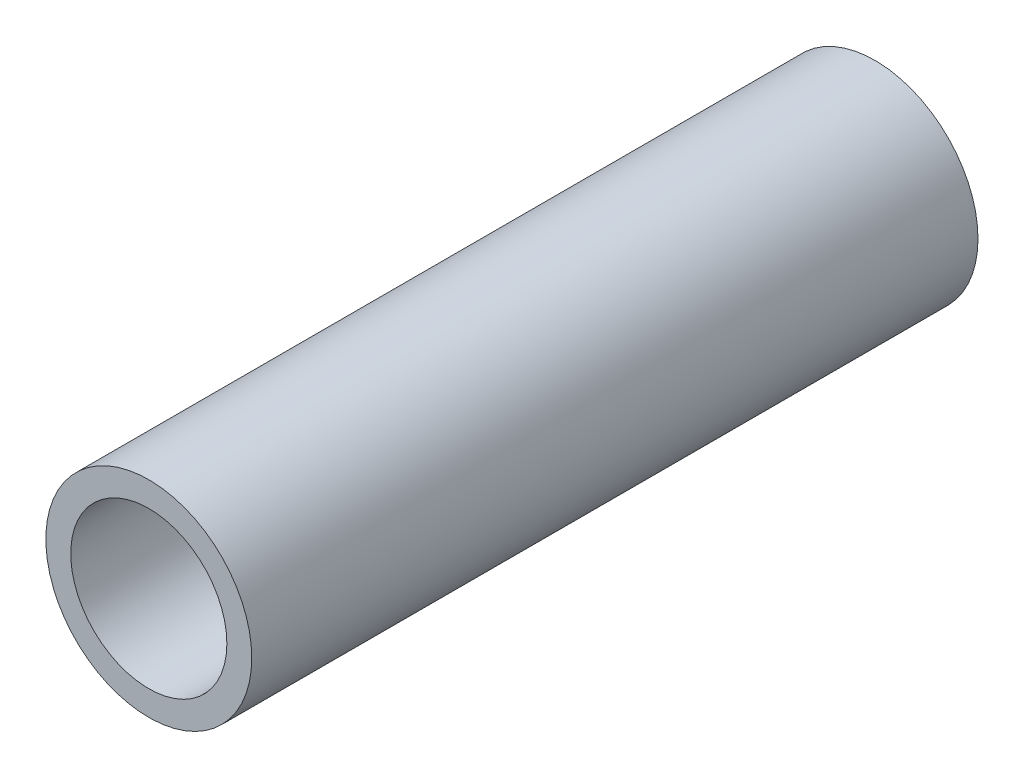
from build123d import *

# Parameters (mm, degrees)
SKETCH12_R          = 259.265
SKETCH12_R_2        = 196.6
BOSS_EXTRUDE1_DEPTH = 1828.8


with BuildPart() as part:
    # Sketch12 → Boss-Extrude1 (new body)
    with BuildSketch(Plane.XY):
        Circle(SKETCH12_R)
        Circle(SKETCH12_R_2, mode=Mode.SUBTRACT)
    extrude(amount=BOSS_EXTRUDE1_DEPTH)


solid = part.part
